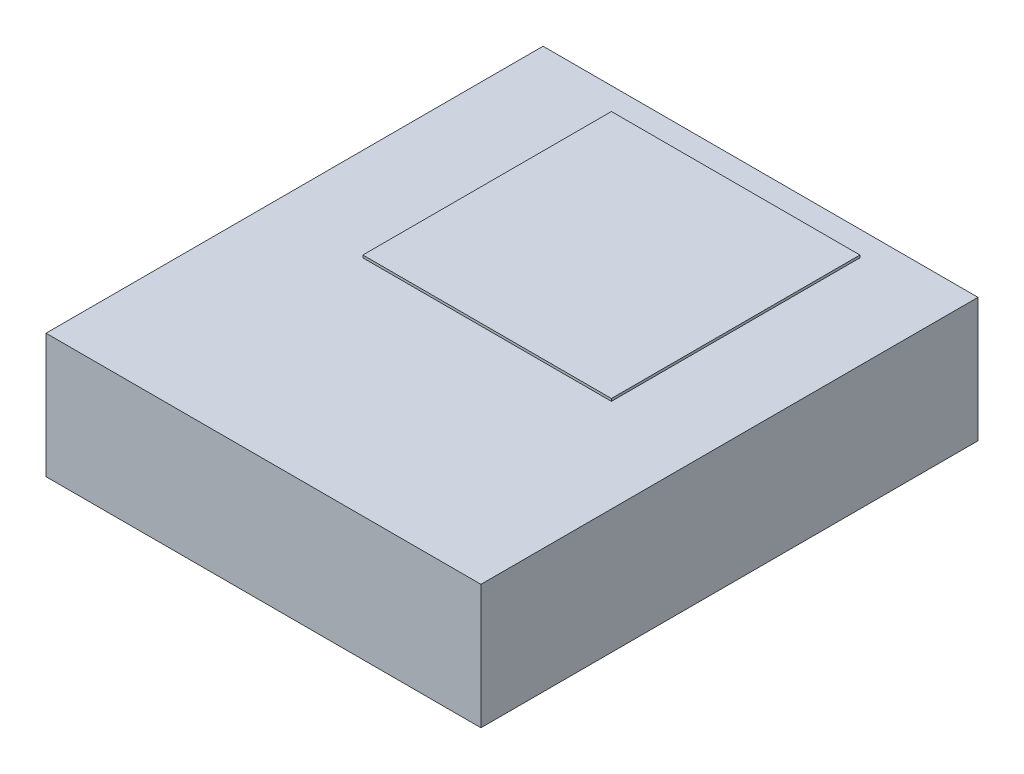
from build123d import *

# Parameters (mm, degrees)
SCHIZZO1_W                   = 1.75
SCHIZZO1_H                   = 2
ESTRUSIONE_ESTRUSIONE1_DEPTH = 0.5
SCHIZZO2_W                   = 1
SCHIZZO2_H                   = 1
ESTRUSIONE_ESTRUSIONE2_DEPTH = 0.01


with BuildPart() as part:
    # Schizzo1 → Estrusione-Estrusione1 (new body)
    with BuildSketch(Plane(origin=(0, 0, 0), x_dir=(1, 0, 0), z_dir=(0, 1, 0))):
        with Locations((-12.664027306, -6.581855291)):
            Rectangle(SCHIZZO1_W, SCHIZZO1_H)
    extrude(amount=ESTRUSIONE_ESTRUSIONE1_DEPTH)

    # Schizzo2 → Estrusione-Estrusione2 (add)
    with BuildSketch(Plane(origin=(0, 0.5, 0), x_dir=(1, 0, 0), z_dir=(0, 1, 0))):
        with Locations((-12.664027306, -6.181855291)):
            Rectangle(SCHIZZO2_W, SCHIZZO2_H)
    extrude(amount=ESTRUSIONE_ESTRUSIONE2_DEPTH)


solid = part.part
